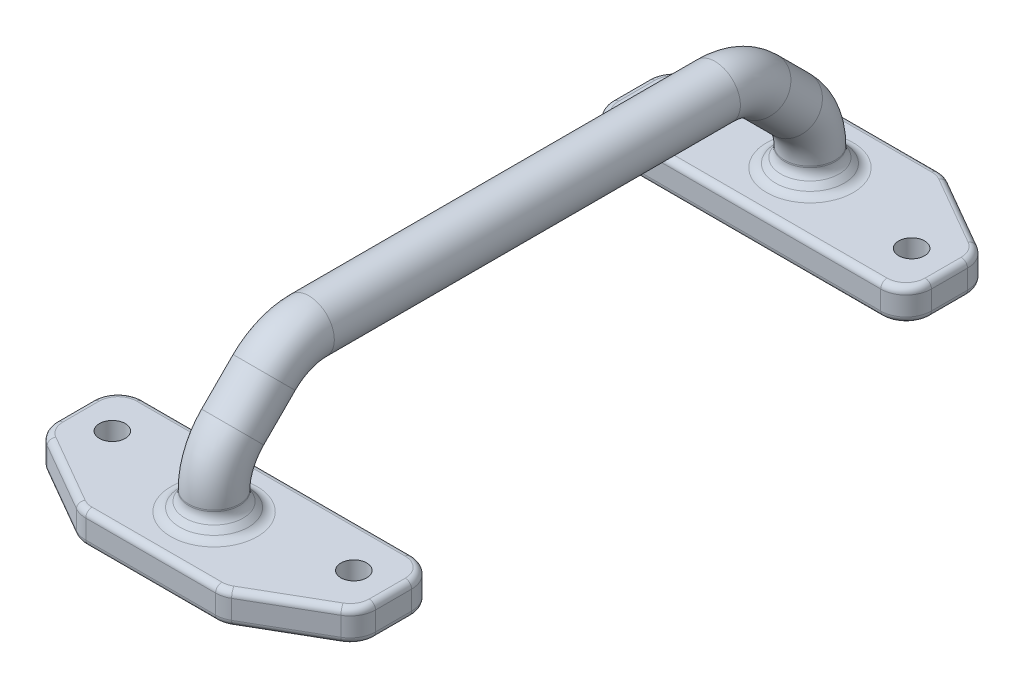
from build123d import *
from OCP.BRepFilletAPI import BRepFilletAPI_MakeChamfer

# Parameters (mm, degrees)
SKETCH1_W           = 79.90459
SKETCH1_H           = 22.225
SKETCH1_R           = 3.2385
BOSS_EXTRUDE1_DEPTH = 7.9375
SKETCH6_W           = 79.90459
SKETCH6_H           = 7.9375
BOSS_EXTRUDE3_DEPTH = 9.525
SKETCH5_R           = 6.35
CHAMFER1_SIZE       = 3.175
CHAMFER2_SIZE       = 12.7
CHAMFER2_SIZE2      = 21.997045256
FILLET1_R           = 3.175
FILLET3_R           = 6.35
FILLET4_R           = 1.5875


with BuildPart() as part:
    # Sketch1 → Boss-Extrude1 (new body)
    with BuildSketch(Plane(origin=(0, 0, 0), x_dir=(1, 0, 0), z_dir=(0, 1, 0))):
        with Locations((-92.075, 0)):
            Rectangle(SKETCH1_W, SKETCH1_H)
        with Locations(Location((-122.311795, 0, 0), (0, 0, 270))):
            Circle(SKETCH1_R, mode=Mode.SUBTRACT)
        with Locations(Location((-61.838205, 0, 0), (0, 0, 270))):
            Circle(SKETCH1_R, mode=Mode.SUBTRACT)
    extrude(amount=BOSS_EXTRUDE1_DEPTH)

    # Sketch6 → Boss-Extrude3 (add)
    with BuildSketch(Plane(origin=(0, 0, -11.1125), x_dir=(-1, 0, 0), z_dir=(0, 0, -1))):
        with Locations((92.075, 3.96875)):
            Rectangle(SKETCH6_W, SKETCH6_H)
    extrude(amount=BOSS_EXTRUDE3_DEPTH)


with BuildPart() as body_2:
    # Mirror3: mirrored copy
    add(part.part.mirror(Plane.XY.offset(69.85)))


with BuildPart() as part_1:
    add(part.part)

    add(body_2.part)  # Sweep1 merges body 2
    # Sweep1: sweep along a path in Sketch4
    with BuildLine(Plane(origin=(-92.075, 0, 0), x_dir=(0, 0, -1), z_dir=(1, 0, 0))) as sweep1_path:
        Line((-147.6375, 7.9375), (-147.6375, 12.746731637))
        ThreePointArc((-147.6375, 12.746731637), (-146.187405094, 20.036851023), (-142.057884182, 26.217115818))
        Line((-142.057884182, 26.217115818), (-134.167115818, 34.107884182))
        ThreePointArc((-134.167115818, 34.107884182), (-127.986851023, 38.237405094), (-120.696731637, 39.6875))
        Line((-120.696731637, 39.6875), (-19.003268363, 39.6875))
        ThreePointArc((-19.003268363, 39.6875), (-11.713148977, 38.237405094), (-5.532884182, 34.107884182))
        Line((-5.532884182, 34.107884182), (2.357884182, 26.217115818))
        ThreePointArc((2.357884182, 26.217115818), (6.487405094, 20.036851023), (7.9375, 12.746731637))
        Line((7.9375, 12.746731637), (7.9375, 7.9375))
    # Sketch5 → Sweep1 (sweep)
    with BuildSketch(Plane(origin=(0, 7.9375, 0), x_dir=(1, 0, 0), z_dir=(0, 1, 0))):
        with Locations((-92.075, 4.7625)):
            Circle(SKETCH5_R)
    sweep(path=sweep1_path.line)

    # Chamfer1
    chamfer1_edges = [part_1.edges().sort_by_distance(p)[0] for p in [
        (-98.425, 7.9375, 144.4625),
        (-98.425, 7.9375, -4.7625),
    ]]
    chamfer(chamfer1_edges, length=CHAMFER1_SIZE)

    # Chamfer2: one chamfer whose edges measure the first distance from different faces: ONE call of the kernel's chamfer builder (chamfer() names one face for all edges)
    chamfer2_edges_1 = [part_1.edges().sort_by_distance(p)[0] for p in [
        (-52.122705, 3.96875, -20.6375),
    ]]
    chamfer2_side_1 = [part_1.faces().sort_by_distance(p)[0] for p in [
        (-52.122705, 3.96875, -4.7625),
    ]]
    chamfer2_edges_2 = [part_1.edges().sort_by_distance(p)[0] for p in [
        (-132.027295, 3.96875, -20.6375),
    ]]
    chamfer2_side_2 = [part_1.faces().sort_by_distance(p)[0] for p in [
        (-132.027295, 3.96875, -4.7625),
    ]]
    chamfer2_edges_3 = [part_1.edges().sort_by_distance(p)[0] for p in [
        (-52.122705, 3.96875, 160.3375),
    ]]
    chamfer2_side_3 = [part_1.faces().sort_by_distance(p)[0] for p in [
        (-52.122705, 3.96875, 144.4625),
    ]]
    chamfer2_edges_4 = [part_1.edges().sort_by_distance(p)[0] for p in [
        (-132.027295, 3.96875, 160.3375),
    ]]
    chamfer2_side_4 = [part_1.faces().sort_by_distance(p)[0] for p in [
        (-132.027295, 3.96875, 144.4625),
    ]]
    chamfer2 = BRepFilletAPI_MakeChamfer(part_1.part.solid().wrapped)
    for e in chamfer2_edges_1:
        chamfer2.Add(CHAMFER2_SIZE, CHAMFER2_SIZE2, e.wrapped, chamfer2_side_1[0].wrapped)  # the first distance lies on this face
    for e in chamfer2_edges_2:
        chamfer2.Add(CHAMFER2_SIZE, CHAMFER2_SIZE2, e.wrapped, chamfer2_side_2[0].wrapped)  # the first distance lies on this face
    for e in chamfer2_edges_3:
        chamfer2.Add(CHAMFER2_SIZE, CHAMFER2_SIZE2, e.wrapped, chamfer2_side_3[0].wrapped)  # the first distance lies on this face
    for e in chamfer2_edges_4:
        chamfer2.Add(CHAMFER2_SIZE, CHAMFER2_SIZE2, e.wrapped, chamfer2_side_4[0].wrapped)  # the first distance lies on this face
    add(Compound.cast(chamfer2.Shape()), mode=Mode.REPLACE)

    # Fillet1
    fillet1_edges = [part_1.edges().sort_by_distance(p)[0] for p in [
        (-101.6, 7.9375, 144.4625),
        (-98.425, 11.1125, 144.4625),
        (-98.425, 11.1125, -4.7625),
        (-101.6, 7.9375, -4.7625),
    ]]
    fillet(fillet1_edges, radius=FILLET1_R)

    # Fillet3
    fillet3_edges = [part_1.edges().sort_by_distance(p)[0] for p in [
        (-52.122705, 3.96875, 11.1125),
        (-132.027295, 3.96875, 11.1125),
        (-132.027295, 3.96875, 128.5875),
        (-52.122705, 3.96875, 128.5875),
        (-52.122705, 3.96875, 147.6375),
        (-110.030249744, 3.96875, 160.3375),
        (-74.119750256, 3.96875, 160.3375),
        (-132.027295, 3.96875, 147.6375),
        (-74.119750256, 3.96875, -20.6375),
        (-110.030249744, 3.96875, -20.6375),
        (-132.027295, 3.96875, -7.9375),
        (-52.122705, 3.96875, -7.9375),
    ]]
    fillet(fillet3_edges, radius=FILLET3_R)

    # Fillet4
    fillet4_edges = [part_1.edges().sort_by_distance(p)[0] for p in [
        (-132.027295, 0, 139.454412895),
        (-132.027295, 7.9375, 139.454412895),
        (-92.075, 7.9375, 160.3375),
        (-63.971966314, 7.9375, 154.478674209),
        (-52.122705, 7.9375, 139.454412895),
        (-92.075, 7.9375, 128.5875),
        (-120.178033686, 7.9375, 154.478674209),
        (-130.167423061, 7.9375, 130.447371939),
        (-53.982576939, 7.9375, 130.447371939),
        (-52.973443686, 7.9375, 147.146325791),
        (-74.177726692, 7.9375, 160.121128997),
        (-109.972273308, 7.9375, 160.121128997),
        (-131.176556314, 7.9375, 147.146325791),
        (-120.178033686, 0, 154.478674209),
        (-52.122705, 0, 139.454412895),
        (-63.971966314, 0, 154.478674209),
        (-92.075, 0, 160.3375),
        (-92.075, 0, 128.5875),
        (-130.167423061, 0, 130.447371939),
        (-53.982576939, 0, 130.447371939),
        (-52.973443686, 0, 147.146325791),
        (-74.177726692, 0, 160.121128997),
        (-109.972273308, 0, 160.121128997),
        (-131.176556314, 0, 147.146325791),
        (-92.075, 0, -20.6375),
        (-92.075, 7.9375, -20.6375),
        (-132.027295, 0, 0.245587105),
        (-120.178033686, 0, -14.778674209),
        (-63.971966314, 0, -14.778674209),
        (-52.122705, 0, 0.245587105),
        (-92.075, 0, 11.1125),
        (-53.982576939, 0, 9.252628061),
        (-130.167423061, 0, 9.252628061),
        (-52.973443686, 0, -7.446325791),
        (-131.176556314, 0, -7.446325791),
        (-109.972273308, 0, -20.421128997),
        (-74.177726692, 0, -20.421128997),
        (-63.971966314, 7.9375, -14.778674209),
        (-120.178033686, 7.9375, -14.778674209),
        (-132.027295, 7.9375, 0.245587105),
        (-92.075, 7.9375, 11.1125),
        (-52.122705, 7.9375, 0.245587105),
        (-53.982576939, 7.9375, 9.252628061),
        (-130.167423061, 7.9375, 9.252628061),
        (-52.973443686, 7.9375, -7.446325791),
        (-131.176556314, 7.9375, -7.446325791),
        (-109.972273308, 7.9375, -20.421128997),
        (-74.177726692, 7.9375, -20.421128997),
    ]]
    fillet(fillet4_edges, radius=FILLET4_R)


solid = part_1.part
